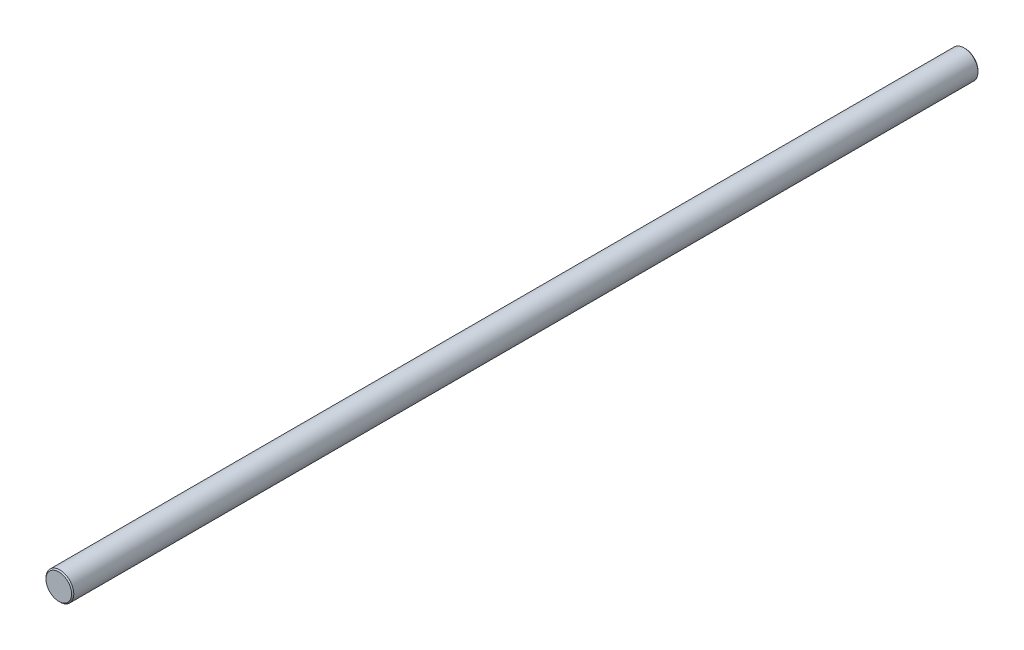
from build123d import *

# Parameters (mm, degrees)
SKETCH_1_R      = 12.5
EXTRUDE_1_DEPTH = 407
CHAMFER_1_SIZE  = 1


with BuildPart() as part:
    # Эскиз1 → Бобышка-Вытянуть1 (new, symmetric)
    with BuildSketch(Plane.XY):
        Circle(SKETCH_1_R)
    extrude(amount=EXTRUDE_1_DEPTH, both=True)

    # Фаска1
    chamfer_1_edges = [part.edges().sort_by_distance(p)[0] for p in [
        (-12.5, 0, -407),
        (-12.5, 0, 407),
    ]]
    chamfer(chamfer_1_edges, length=CHAMFER_1_SIZE)


solid = part.part
